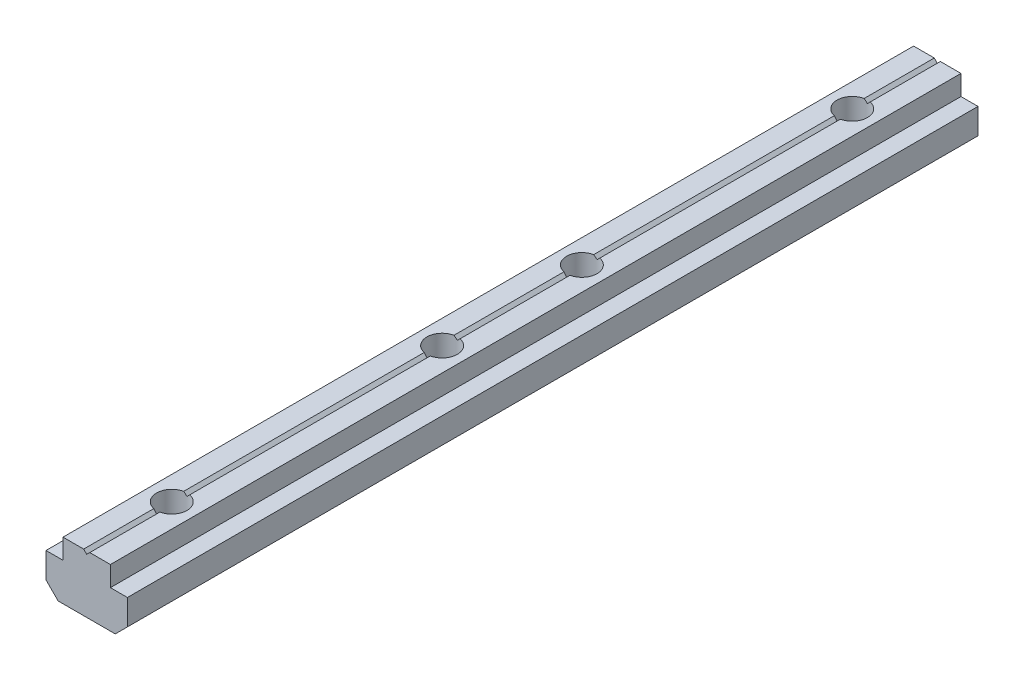
from build123d import *

# Parameters (mm, degrees)
EXTRUDE_1_DEPTH        = 140
HOLE_WIZARD_M6_1_D     = 5
HOLE_WIZARD_M6_1_DEPTH = 28
HOLE_WIZARD_M6_1_TIP   = 1.502151548


with BuildPart() as part:
    # 草图1 → 凸台-拉伸1 (new body)
    with BuildSketch(Plane.XY):
        Polygon((-2, -6.2), (-11.4, -6.2), (-13.4, -4.2), (-13.4, 0), (-10.6, 0), (-10.6, 3.3), (-7.2, 3.3), (-6.7, 2.8), (-6.2, 3.3), (-2.8, 3.3), (-2.8, 0), (0, 0), (0, -4.2), align=None)
    extrude(amount=EXTRUDE_1_DEPTH)

    # M6 螺纹孔1
    with Locations(Plane(origin=(-6.7, -6.2, 14), x_dir=(-1, 0, 0), z_dir=(0, -1, 0))):
        with Locations((0, 0), (0, -44.5), (0, -67.5), (0, -112)):
            Hole(HOLE_WIZARD_M6_1_D / 2, depth=HOLE_WIZARD_M6_1_DEPTH)
            with Locations((0, 0, -(HOLE_WIZARD_M6_1_DEPTH + HOLE_WIZARD_M6_1_TIP / 2))):  # 118° drill point
                Cone(0, HOLE_WIZARD_M6_1_D / 2, HOLE_WIZARD_M6_1_TIP, mode=Mode.SUBTRACT)


solid = part.part
